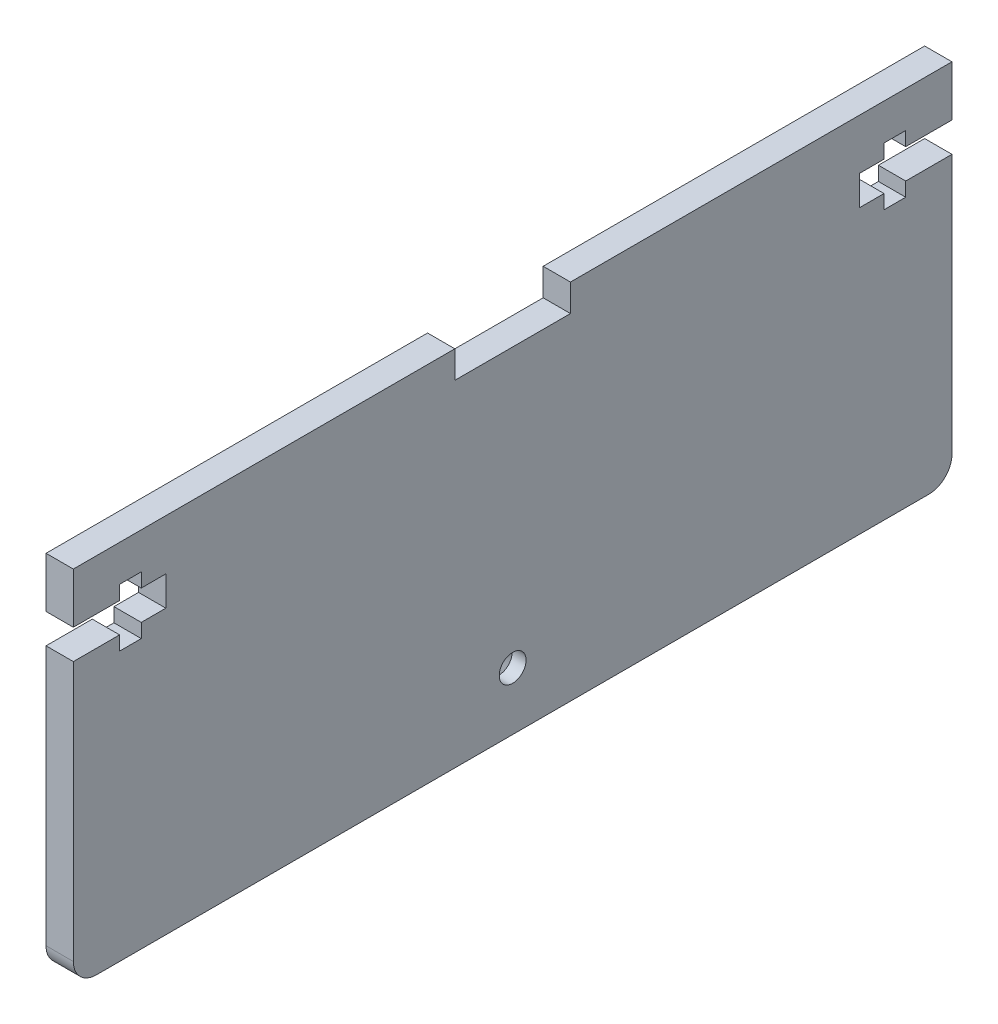
from build123d import *

# Parameters (mm, degrees)
SKETCH1_W                       = 96.52
SKETCH1_H                       = 39.878
BOSS_EXTRUDE1_DEPTH             = 3
F_32_0_116_DIAMETER_HOLE1_D     = 2.9464
F_32_0_116_DIAMETER_HOLE1_DEPTH = 1.524
F_32_0_116_DIAMETER_HOLE1_TIP   = 0.885187864
CUT_EXTRUDE1_DEPTH              = 3
FILLET1_R                       = 2.54
SKETCH5_W                       = 12.7
SKETCH5_H                       = 3
CUT_EXTRUDE2_DEPTH              = 3


with BuildPart() as part:
    # Sketch1 → Boss-Extrude1 (new body)
    with BuildSketch(Plane(origin=(0, 0, 0), x_dir=(0, 0, -1), z_dir=(1, 0, 0))):
        with Locations((48.26, 19.939)):
            Rectangle(SKETCH1_W, SKETCH1_H)
    extrude(amount=BOSS_EXTRUDE1_DEPTH)

    # #32 (0.116) Diameter Hole1
    with Locations(Plane(origin=(3, 0, 0), x_dir=(0, 0, -1), z_dir=(1, 0, 0))):
        with Locations((48.26, 6.35)):
            Hole(F_32_0_116_DIAMETER_HOLE1_D / 2, depth=F_32_0_116_DIAMETER_HOLE1_DEPTH)
            with Locations((0, 0, -(F_32_0_116_DIAMETER_HOLE1_DEPTH + F_32_0_116_DIAMETER_HOLE1_TIP / 2))):  # 118° drill point
                Cone(0, F_32_0_116_DIAMETER_HOLE1_D / 2, F_32_0_116_DIAMETER_HOLE1_TIP, mode=Mode.SUBTRACT)

    # Sketch4 → Cut-Extrude1 (cut)
    with BuildSketch(Plane(origin=(3, 0, 0), x_dir=(0, 0, -1), z_dir=(1, 0, 0))):
        Polygon((0, 34.338), (5.08, 34.338), (5.08, 35.88105), (7.46125, 35.88105), (7.46125, 34.338), (10.16, 34.338), (10.16, 31.0741), (7.46125, 31.0741), (7.46125, 29.53105), (5.08, 29.53105), (5.08, 31.0741), (0, 31.0741), align=None)
        Polygon((96.52, 31.0741), (96.52, 34.338), (91.44, 34.338), (91.44, 35.88105), (89.05875, 35.88105), (89.05875, 34.338), (86.36, 34.338), (86.36, 31.0741), (89.05875, 31.0741), (89.05875, 29.53105), (91.44, 29.53105), (91.44, 31.0741), align=None)
    extrude(amount=-CUT_EXTRUDE1_DEPTH, mode=Mode.SUBTRACT)

    # Fillet1
    fillet1_edges = [part.edges().sort_by_distance(p)[0] for p in [
        (1.5, 0, -96.52),
        (1.5, 0, 0),
    ]]
    fillet(fillet1_edges, radius=FILLET1_R)

    # Sketch5 → Cut-Extrude2 (cut)
    with BuildSketch(Plane(origin=(3, 0, 0), x_dir=(0, 0, -1), z_dir=(1, 0, 0))):
        with Locations((48.26, 38.378)):
            Rectangle(SKETCH5_W, SKETCH5_H)
    extrude(amount=-CUT_EXTRUDE2_DEPTH, mode=Mode.SUBTRACT)


solid = part.part
